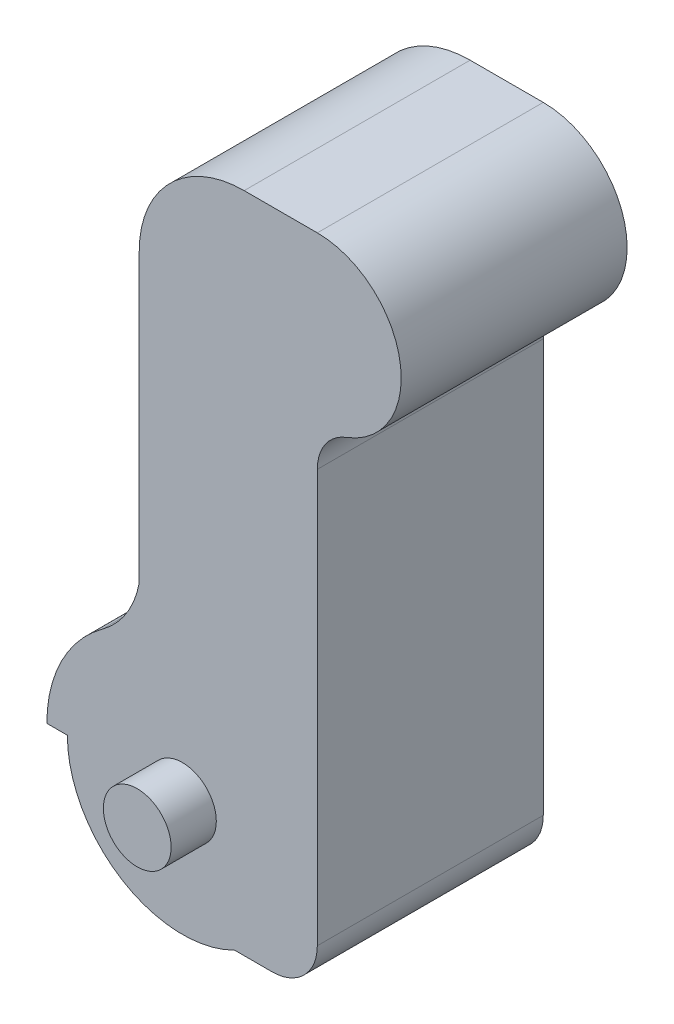
from build123d import *

# Parameters (mm, degrees)
BOSS_EXTRUDE2_DEPTH = 10
SKETCH3_R           = 1.5
BOSS_EXTRUDE3_DEPTH = 2


with BuildPart() as part:
    # Sketch1 → Boss-Extrude2 (new body)
    with BuildSketch(Plane.XY):
        with BuildLine():
            Line((7.884962528, 10.248457422), (7.884962528, -2.471687197))
            ThreePointArc((7.884962528, -2.471687197), (7.318196318, -3.914788011), (6.259459635, -5.047413515))
            ThreePointArc((6.259459635, -5.047413515), (4.447305875, -7.175808801), (3.796141897, -9.894255639))
            Line((3.796141897, -9.894255639), (4.70457442, -9.894255639))
            ThreePointArc((4.70457442, -9.894255639), (7.134282097, -14.234596844), (12.104480976, -14.432496496))
            Line((12.104480976, -14.432496496), (13.766372841, -14.432496496))
            ThreePointArc((13.766372841, -14.432496496), (15.180586403, -13.846710058), (15.766372841, -12.432496496))
            Line((15.766372841, -12.432496496), (15.766372841, 5.828797616))
            ThreePointArc((15.766372841, 5.828797616), (16.123155433, 6.968901362), (17.066209392, 7.702235938))
            ThreePointArc((17.066209392, 7.702235938), (19.42011278, 11.840679713), (15.766372841, 14.893180737))
            Line((15.766372841, 14.893180737), (12.529685844, 14.893180737))
            ThreePointArc((12.529685844, 14.893180737), (9.245370491, 13.532772775), (7.884962528, 10.248457422))
        make_face()
    extrude(amount=BOSS_EXTRUDE2_DEPTH)

    # Sketch3 → Boss-Extrude3 (add)
    with BuildSketch(Plane.XY.offset(10)):
        with Locations((9.796141897, -9.894255639)):
            Circle(SKETCH3_R)
    extrude(amount=BOSS_EXTRUDE3_DEPTH)


solid = part.part
